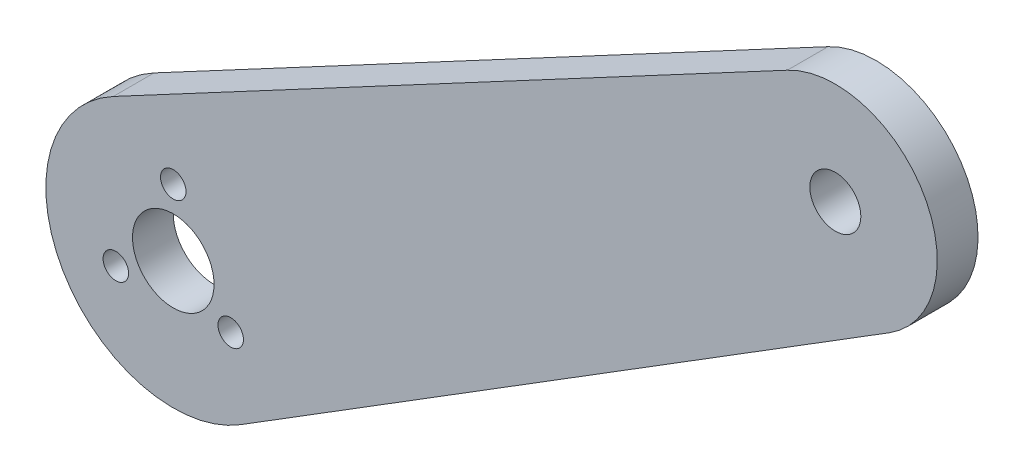
from build123d import *

# Parameters (mm, degrees)
SKETCH1_R           = 12.5
SKETCH1_R_2         = 4
SKETCH1_R_3         = 1.25
SKETCH1_R_4         = 10
SKETCH1_R_5         = 2.5
BOSS_EXTRUDE1_DEPTH = 4


with BuildPart() as part:
    # Sketch1 → Boss-Extrude1 (new body)
    # profile 1 of 3: a face of its own
    with BuildSketch(Plane.XY):
        Circle(SKETCH1_R)
        Circle(SKETCH1_R_2, mode=Mode.SUBTRACT)
        with Locations((0, 6.505402357)):
            Circle(SKETCH1_R_3, mode=Mode.SUBTRACT)
        with Locations((5.633843703, -3.252701179)):
            Circle(SKETCH1_R_3, mode=Mode.SUBTRACT)
        with Locations((-5.633843703, -3.252701179)):
            Circle(SKETCH1_R_3, mode=Mode.SUBTRACT)
    # profile 2 of 3: a face of its own
    with BuildSketch(Plane.XY):
        with BuildLine():
            ThreePointArc((70.237801869, 29.011225218), (56.291651246, 32.5), (60.243358968, 46.322108115))
            Line((60.243358968, 46.322108115), (-5.885682894, 11.027635144))
            ThreePointArc((-5.885682894, 11.027635144), (6.429578673, 10.719632367), (12.5, 0))
            ThreePointArc((12.5, 0), (10.92799465, -6.068684613), (6.607370731, -10.610968477))
            Line((6.607370731, -10.610968477), (70.237801869, 29.011225218))
        make_face()
    # profile 3 of 3: a face of its own
    with BuildSketch(Plane.XY):
        with Locations((64.951905284, 37.5)):
            Circle(SKETCH1_R_4)
        with Locations((64.951905284, 37.5)):
            Circle(SKETCH1_R_5, mode=Mode.SUBTRACT)
    extrude(amount=BOSS_EXTRUDE1_DEPTH)


solid = part.part
